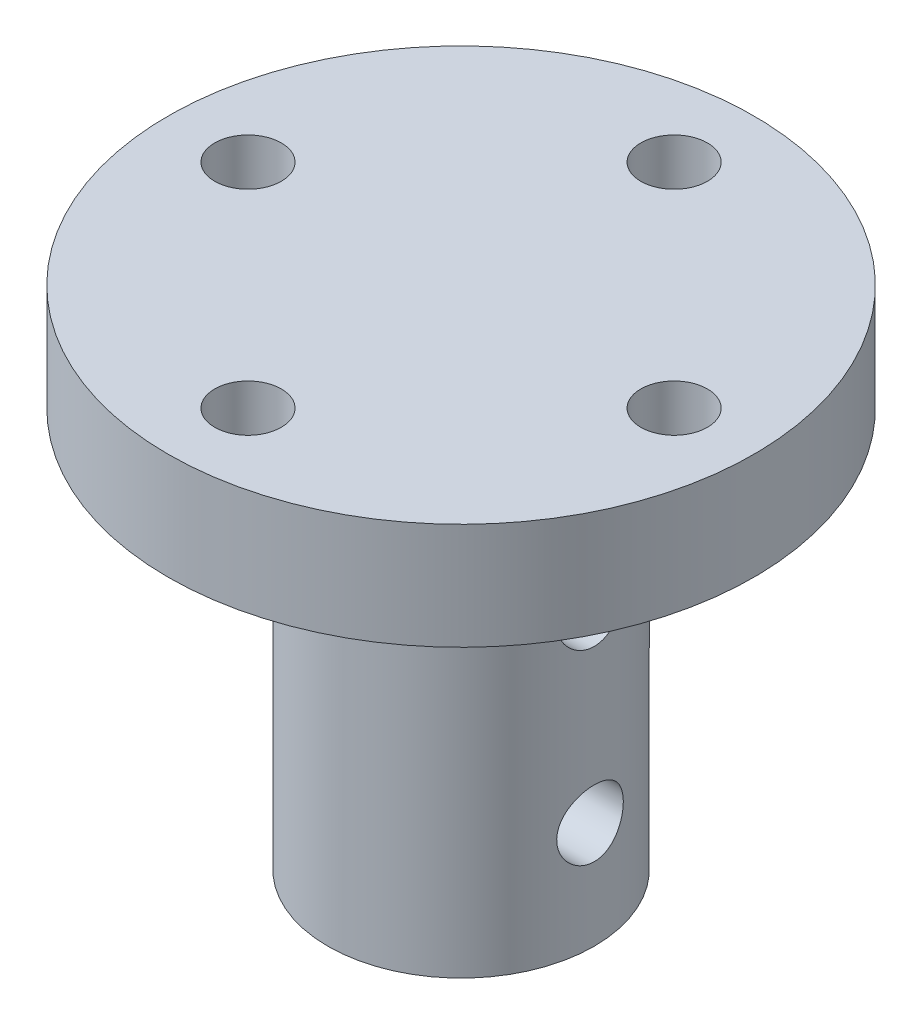
from build123d import *

# Parameters (mm, degrees)
SKETCH1_R           = 11
BOSS_EXTRUDE1_DEPTH = 4
SKETCH5_R           = 5
SKETCH5_R_2         = 2
BOSS_EXTRUDE2_DEPTH = 15
SKETCH2_R           = 1.25
CUT_EXTRUDE1_DEPTH  = 10
SKETCH20_R          = 1.25
CUT_EXTRUDE2_DEPTH  = 4


with BuildPart() as part:
    # Sketch1 → Boss-Extrude1 (new body)
    with BuildSketch(Plane(origin=(0, 0, 0), x_dir=(1, 0, 0), z_dir=(0, 1, 0))):
        with Locations(Location((0, 0, 0), (0, 0, 270))):
            Circle(SKETCH1_R)
    extrude(amount=BOSS_EXTRUDE1_DEPTH)

    # Sketch5 → Boss-Extrude2 (add)
    with BuildSketch(Plane.XZ):
        with Locations(Location((0, 0, 0), (0, 0, 90))):
            Circle(SKETCH5_R)
        with Locations(Location((0, 0, 0), (0, 0, 270))):
            Circle(SKETCH5_R_2, mode=Mode.SUBTRACT)
    extrude(amount=BOSS_EXTRUDE2_DEPTH)

    # Sketch2 → Cut-Extrude1 (cut)
    with BuildSketch(Plane.XZ):
        with Locations(Location((0, -8, 0), (0, 0, 270))):
            Circle(SKETCH2_R)
        with Locations(Location((-8, 0, 0), (0, 0, 270))):
            Circle(SKETCH2_R)
        with Locations(Location((0, 8, 0), (0, 0, 270))):
            Circle(SKETCH2_R)
        with Locations(Location((8, 0, 0), (0, 0, 270))):
            Circle(SKETCH2_R)
    extrude(amount=-CUT_EXTRUDE1_DEPTH, mode=Mode.SUBTRACT)

    # Sketch20 → Cut-Extrude2 (cut)
    with BuildSketch(Plane(origin=(5, 0, 0), x_dir=(0, 0, -1), z_dir=(1, 0, 0))):
        with Locations((0, -4)):
            Circle(SKETCH20_R)
        with Locations((0, -11)):
            Circle(SKETCH20_R)
    extrude(amount=-CUT_EXTRUDE2_DEPTH, mode=Mode.SUBTRACT)


solid = part.part
